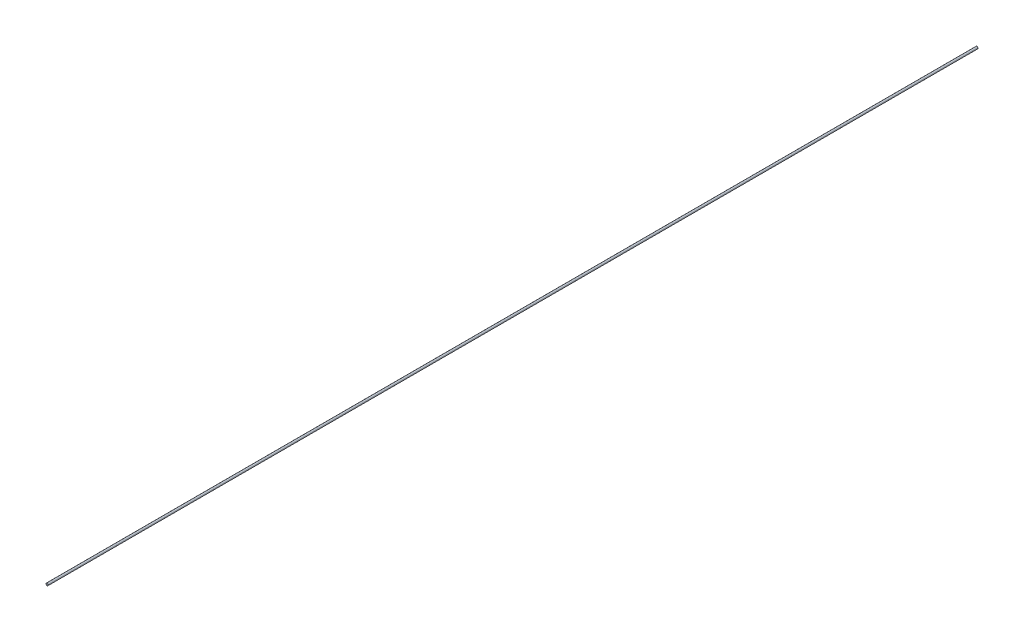
from build123d import *

# Parameters (mm, degrees)
SKETCH1_R           = 0.3556
BOSS_EXTRUDE1_DEPTH = 304.8


with BuildPart() as part:
    # Sketch1 → Boss-Extrude1 (new body)
    with BuildSketch(Plane.XY):
        Circle(SKETCH1_R)
    extrude(amount=BOSS_EXTRUDE1_DEPTH)


solid = part.part
